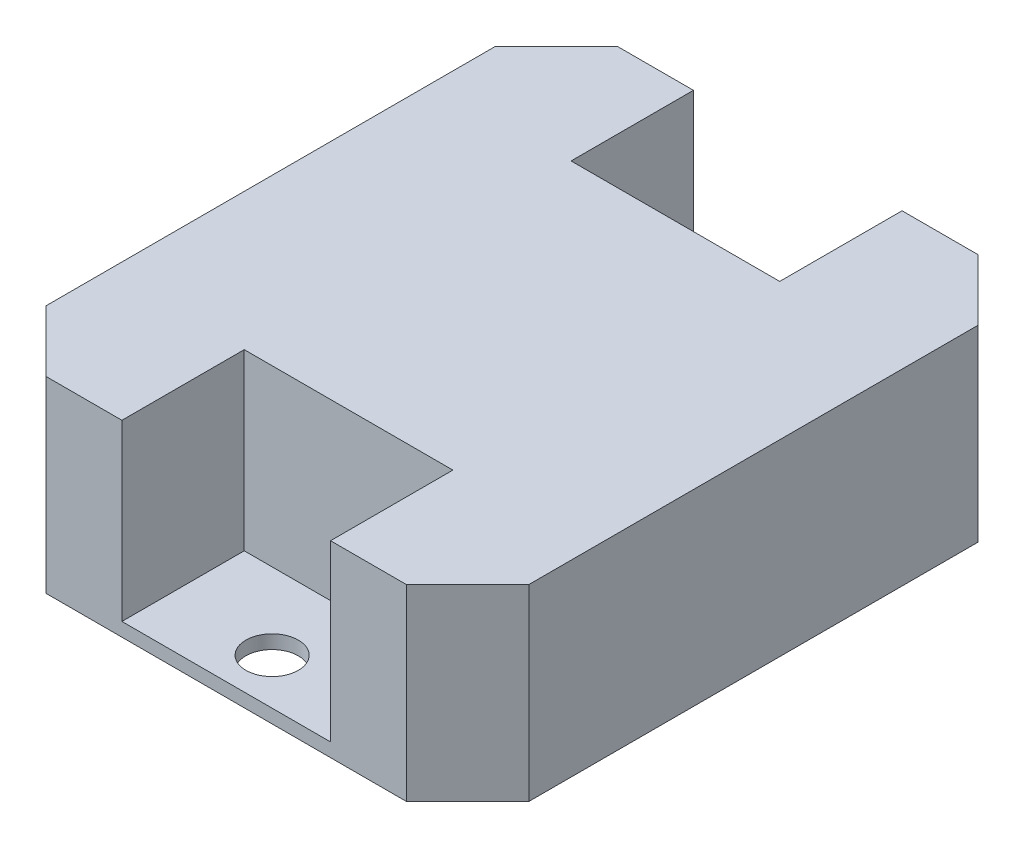
from build123d import *

# Parameters (mm, degrees)
SKETCH1_R           = 3.048
BOSS_EXTRUDE1_DEPTH = 21.844
SKETCH2_W           = 24.257
SKETCH2_H           = 14.478
CUT_EXTRUDE1_DEPTH  = 20.2565


with BuildPart() as part:
    # Sketch1 → Boss-Extrude1 (new body)
    with BuildSketch(Plane(origin=(0, 0, 0), x_dir=(1, 0, 0), z_dir=(0, 1, 0))):
        Polygon((-28.065439725, 26.112877044), (-20.953014773, 33.224452067), (20.956985152, 33.221947814), (28.068560175, 26.109522863), (28.065439725, -26.112877044), (20.953014773, -33.224452067), (-20.956985152, -33.221947814), (-28.068560175, -26.109522863), align=None)
        with Locations(Location((0.001666466, 27.88919995, 0), (0, 0, 270))):
            Circle(SKETCH1_R, mode=Mode.SUBTRACT)
        with Locations(Location((-0.001666466, -27.88919995, 0), (0, 0, 270))):
            Circle(SKETCH1_R, mode=Mode.SUBTRACT)
    extrude(amount=BOSS_EXTRUDE1_DEPTH)

    # Sketch2 → Cut-Extrude1 (cut)
    with BuildSketch(Plane(origin=(0, 21.844, 0), x_dir=(1, 0, 0), z_dir=(0, 1, 0))):
        with Locations((-0.001985189, -26.238199941)):
            Rectangle(SKETCH2_W, SKETCH2_H)
        with Locations((-0.001985189, 26.238168907)):
            Rectangle(SKETCH2_W, SKETCH2_H)
    extrude(amount=-CUT_EXTRUDE1_DEPTH, mode=Mode.SUBTRACT)


solid = part.part
